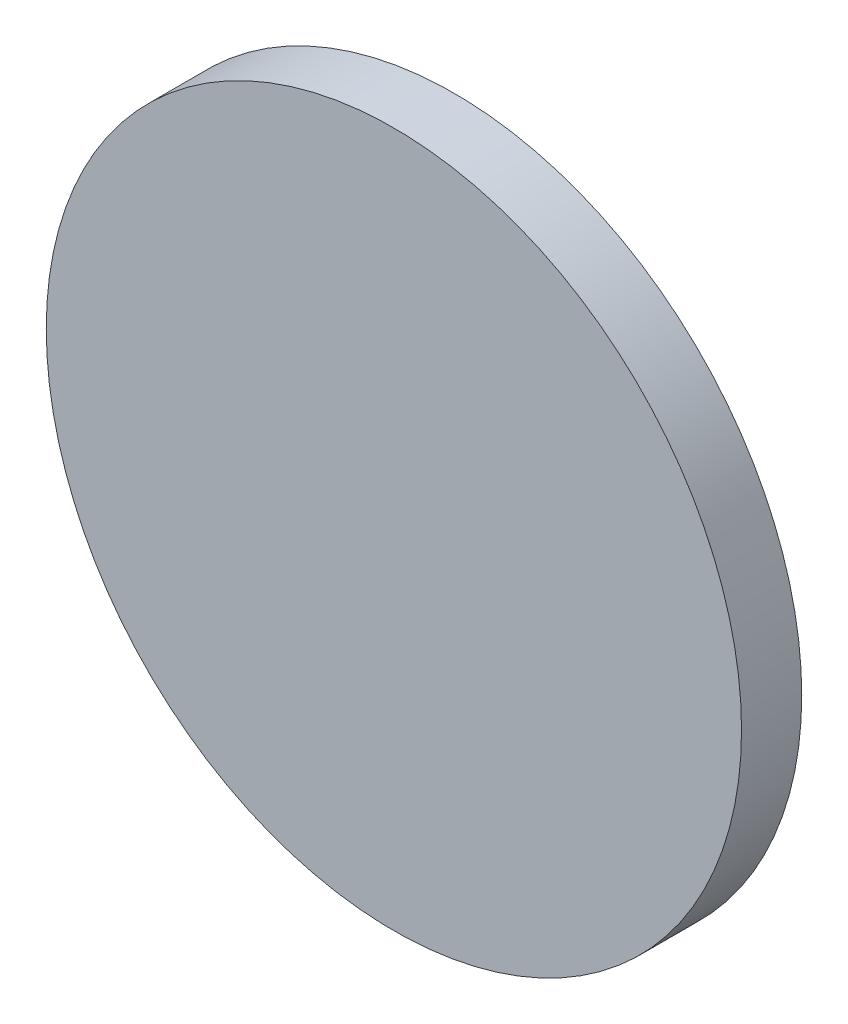
from build123d import *

# Parameters (mm, degrees)
SKETCH1_R           = 6.35
BOSS_EXTRUDE1_DEPTH = 1.1


with BuildPart() as part:
    # Sketch1 → Boss-Extrude1 (new body)
    with BuildSketch(Plane.XY):
        Circle(SKETCH1_R)
    extrude(amount=BOSS_EXTRUDE1_DEPTH)


solid = part.part
